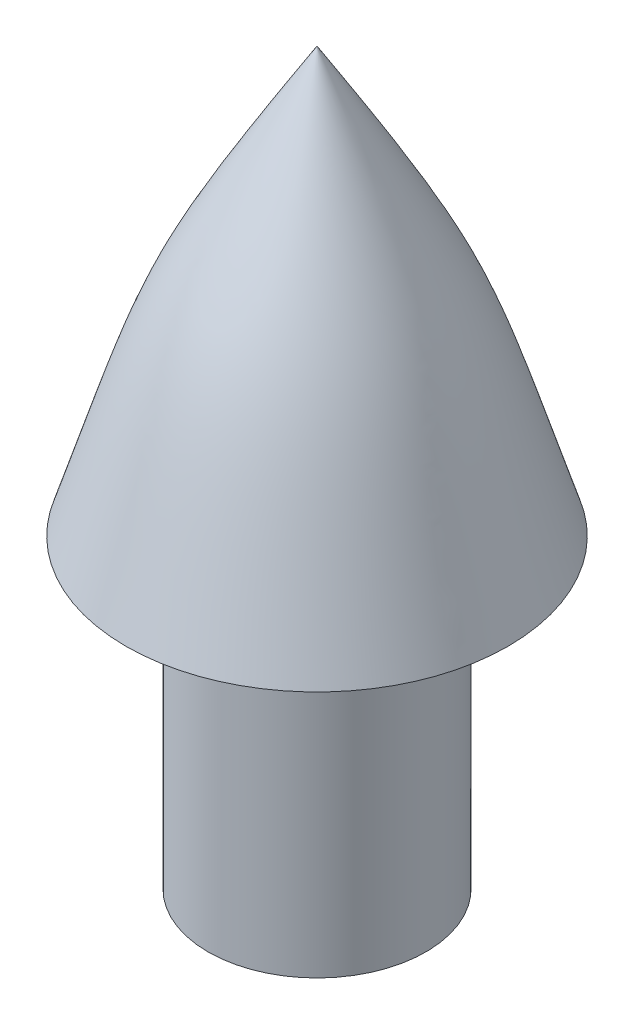
from build123d import *


with BuildPart() as part:
    # Sketch1 → Revolve1 (revolve)
    with BuildSketch(Plane.XY, mode=Mode.PRIVATE) as revolve1_sk:
        with BuildLine():
            Line((2.5, 0), (1.425, 0))
            Line((1.425, 0), (1.425, -4))
            Line((1.425, -4), (0, -4))
            Line((0, -4), (0, 5.55))
            add(Edge.make_bspline(
                [(0, 5.55), (1.744782971, 2.714606366), (1.637494634, 2.740736432), (2.5, 0)],
                knots=[0, 0, 0, 0, 1, 1, 1, 1], degree=3))
        make_face()
    revolve(revolve1_sk.sketch.rotate(Axis((0, 5.858681703, 0), (0, -1, 0)), 90), axis=Axis((0, 5.858681703, 0), (0, -1, 0)))


solid = part.part
